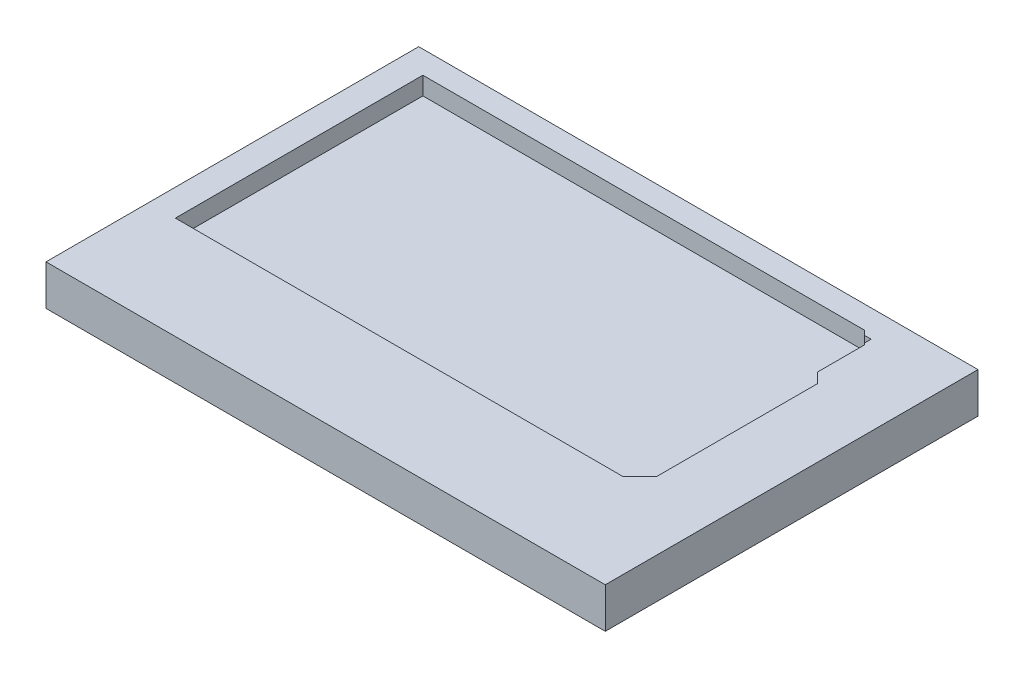
from build123d import *

# Parameters (mm, degrees)
SKETCH1_W           = 100
SKETCH1_H           = 53
BOSS_EXTRUDE1_DEPTH = 5
SKETCH2_R           = 1.5875
CUT_EXTRUDE1_DEPTH  = 57.808890149
SKETCH3_W           = 124.759549129
SKETCH3_H           = 83.141448462
BOSS_EXTRUDE2_DEPTH = 9
SKETCH4_W           = 124.759549129
SKETCH4_H           = 83.141448462
BOSS_EXTRUDE3_DEPTH = 5


with BuildPart() as part:
    # Sketch1 → Boss-Extrude1 (new body)
    with BuildSketch(Plane(origin=(0, 0, 0), x_dir=(1, 0, 0), z_dir=(0, 1, 0))):
        Rectangle(SKETCH1_W, SKETCH1_H)
    extrude(amount=BOSS_EXTRUDE1_DEPTH)

    # Sketch2 → Cut-Extrude1 (cut, through all)
    with BuildSketch(Plane.XZ):
        with Locations(Location((46.52, 24.173, 0), (0, 0, 270))):
            Circle(SKETCH2_R)
        with Locations(Location((40.17, -24.087, 0), (0, 0, 270))):
            Circle(SKETCH2_R)
        with Locations(Location((-34.76, -24.087, 0), (0, 0, 270))):
            Circle(SKETCH2_R)
        with Locations(Location((-36.03, 24.173, 0), (0, 0, 270))):
            Circle(SKETCH2_R)
    extrude(amount=-CUT_EXTRUDE1_DEPTH, mode=Mode.SUBTRACT)

    # Sketch3 → Boss-Extrude2 (add)
    with BuildSketch(Plane.XZ):
        with Locations((5.40179994, 9.020492383)):
            Rectangle(SKETCH3_W, SKETCH3_H)
        Polygon((52.6, -11.939816527), (50.354869769, -14.184946758), (50.354869769, -24.628213562), (50, -24.983083332), (50, -26.5), (48.483083332, -26.5), (47.483083332, -27.5), (-51, -27.5), (-51, 27.713), (48.839213562, 27.713), (52.6, 23.952213562), align=None, mode=Mode.SUBTRACT)
    extrude(amount=-BOSS_EXTRUDE2_DEPTH)

    # Sketch4 → Boss-Extrude3 (add)
    with BuildSketch(Plane.XZ):
        with Locations((5.40179994, 9.020492383)):
            Rectangle(SKETCH4_W, SKETCH4_H)
    extrude(amount=-BOSS_EXTRUDE3_DEPTH)


solid = part.part
